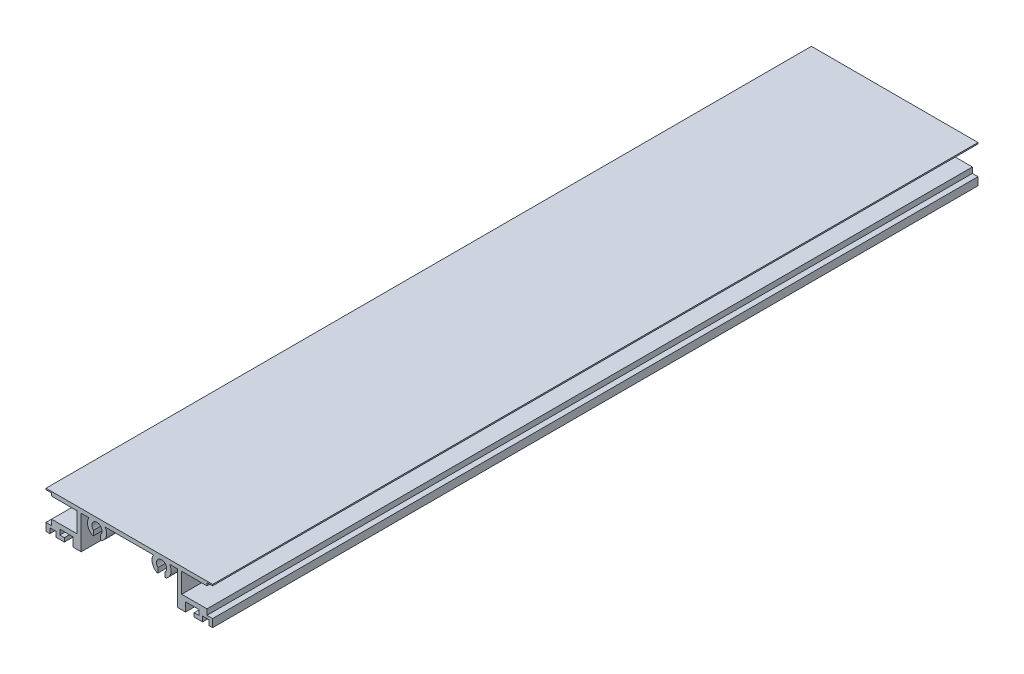
from build123d import *

# Parameters (mm, degrees)
ESTRUSIONE_ESTRUSIONE1_DEPTH = 300
SCHIZZO2_W                   = 3.5
SCHIZZO2_H                   = 4.6
TAGLIO_ESTRUSIONE1_DEPTH     = 303.096048468


with BuildPart() as part:
    # Schizzo1 → Estrusione-Estrusione1 (new body)
    with BuildSketch(Plane.XY):
        with BuildLine():
            Line((-30.15, 14), (-32.65, 14))
            Line((-32.65, 14), (-32.65, 8.9))
            Line((-32.65, 8.9), (-30.45, 8.9))
            Line((-30.45, 8.9), (-30.45, 7.8))
            Line((-30.45, 7.8), (-20.55, 7.8))
            Line((-20.55, 7.8), (-20.55, 0))
            Line((-20.55, 0), (-30.45, 0))
            Line((-30.45, 0), (-30.45, -2.2))
            Line((-30.45, -2.2), (-32.65, -2.2))
            Line((-32.65, -2.2), (-32.65, -5.3))
            Line((-32.65, -5.3), (-31.15, -5.3))
            Line((-31.15, -5.3), (-31.15, -3.3))
            Line((-31.15, -3.3), (-28.75, -3.3))
            Line((-28.75, -3.3), (-28.75, -5.3))
            Line((-28.75, -5.3), (-25.45, -5.3))
            Line((-25.45, -5.3), (-25.45, -3.8))
            Line((-25.45, -3.8), (-27.25, -3.8))
            Line((-27.25, -3.8), (-27.25, -1.8))
            Line((-27.25, -1.8), (-22.05, -1.8))
            Line((-22.05, -1.8), (-22.05, -5.3))
            Line((-22.05, -5.3), (-18.85, -5.3))
            Line((-18.85, -5.3), (-18.85, 7.8))
            Line((-18.85, 7.8), (-15.821542758, 7.8))
            ThreePointArc((-15.821542758, 7.8), (-16.273540604, 4.846345824), (-14.423395659, 2.5))
            Line((-14.423395659, 2.5), (-14.074102014, 2.5))
            Line((-14.074102014, 2.5), (-14.074102014, 4.405182935))
            ThreePointArc((-14.074102014, 4.405182935), (-12.647585955, 7.8), (-11.221069895, 4.405182935))
            Line((-11.221069895, 4.405182935), (-11.221069895, 2.5))
            Line((-11.221069895, 2.5), (-10.87177625, 2.5))
            ThreePointArc((-10.87177625, 2.5), (-9.021631305, 4.846345824), (-9.473629151, 7.8))
            Line((-9.473629151, 7.8), (0, 7.8))
            Line((0, 7.8), (0, 9.4))
            Line((0, 9.4), (-29.15, 9.4))
            Line((-29.15, 9.4), (-29.15, 10.5))
            Line((-29.15, 10.5), (-30.15, 10.5))
            Line((-30.15, 10.5), (-30.15, 14))
        make_face()
        with BuildLine():
            Line((29.15, 9.4), (0, 9.4))
            Line((0, 9.4), (0, 7.8))
            Line((0, 7.8), (9.473629151, 7.8))
            ThreePointArc((9.473629151, 7.8), (9.021631305, 4.846345824), (10.87177625, 2.5))
            Line((10.87177625, 2.5), (11.221069895, 2.5))
            Line((11.221069895, 2.5), (11.221069895, 4.405182935))
            ThreePointArc((11.221069895, 4.405182935), (12.647585955, 7.8), (14.074102014, 4.405182935))
            Line((14.074102014, 4.405182935), (14.074102014, 2.5))
            Line((14.074102014, 2.5), (14.423395659, 2.5))
            ThreePointArc((14.423395659, 2.5), (16.273540604, 4.846345824), (15.821542758, 7.8))
            Line((15.821542758, 7.8), (18.85, 7.8))
            Line((18.85, 7.8), (18.85, -5.3))
            Line((18.85, -5.3), (22.05, -5.3))
            Line((22.05, -5.3), (22.05, -1.8))
            Line((22.05, -1.8), (27.25, -1.8))
            Line((27.25, -1.8), (27.25, -3.8))
            Line((27.25, -3.8), (25.45, -3.8))
            Line((25.45, -3.8), (25.45, -5.3))
            Line((25.45, -5.3), (28.75, -5.3))
            Line((28.75, -5.3), (28.75, -3.3))
            Line((28.75, -3.3), (31.15, -3.3))
            Line((31.15, -3.3), (31.15, -5.3))
            Line((31.15, -5.3), (32.65, -5.3))
            Line((32.65, -5.3), (32.65, -2.2))
            Line((32.65, -2.2), (30.45, -2.2))
            Line((30.45, -2.2), (30.45, 0))
            Line((30.45, 0), (20.55, 0))
            Line((20.55, 0), (20.55, 7.8))
            Line((20.55, 7.8), (30.45, 7.8))
            Line((30.45, 7.8), (30.45, 8.9))
            Line((30.45, 8.9), (32.65, 8.9))
            Line((32.65, 8.9), (32.65, 14))
            Line((32.65, 14), (30.15, 14))
            Line((30.15, 14), (30.15, 10.5))
            Line((30.15, 10.5), (29.15, 10.5))
            Line((29.15, 10.5), (29.15, 9.4))
        make_face()
    extrude(amount=ESTRUSIONE_ESTRUSIONE1_DEPTH)

    # Schizzo2 → Taglio-Estrusione1 (cut, through all)
    with BuildSketch(Plane.XY.offset(300)):
        with Locations((30.9, 11.7)):
            Rectangle(SCHIZZO2_W, SCHIZZO2_H)
    taglio_estrusione1 = extrude(amount=-TAGLIO_ESTRUSIONE1_DEPTH, mode=Mode.SUBTRACT)

    # Specchia1: Taglio-Estrusione1 across plane
    add(taglio_estrusione1.mirror(Plane(origin=(0, 0, 0), x_dir=(0, 0, 1), z_dir=(1, 0, 0))), mode=Mode.SUBTRACT)


solid = part.part
